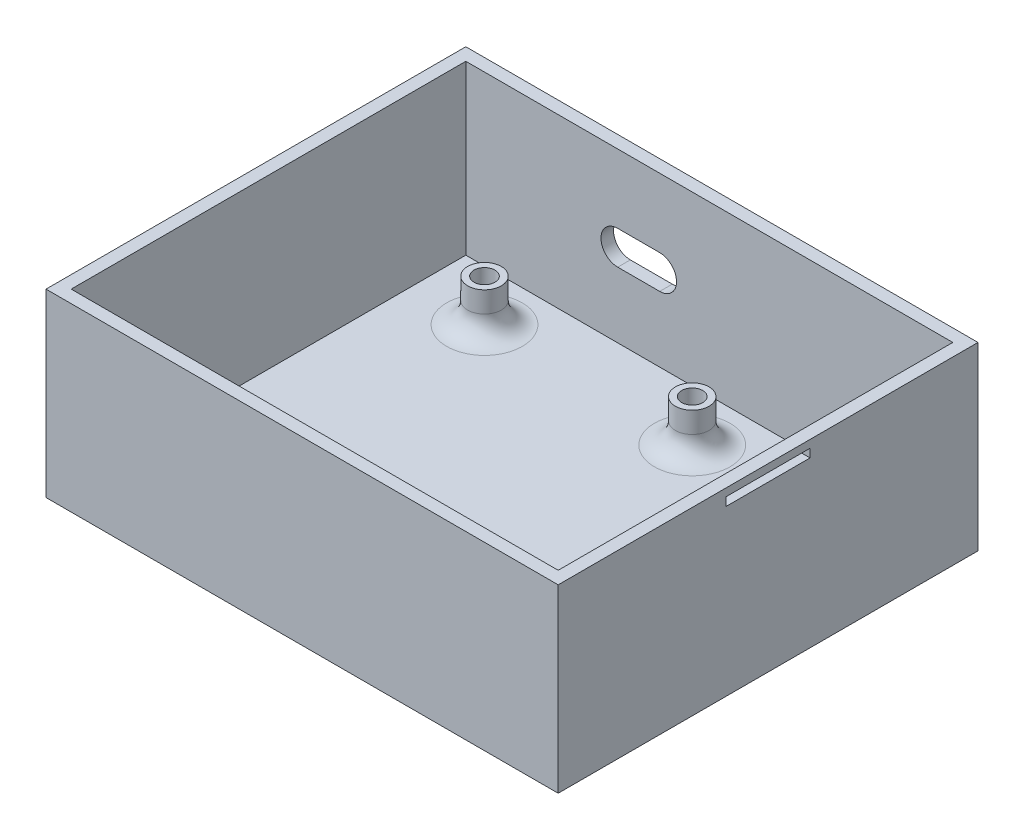
from build123d import *

# Parameters (mm, degrees)
SKETCH1_W           = 122
SKETCH1_H           = 100
BOSS_EXTRUDE1_DEPTH = 3
SKETCH2_W           = 122
SKETCH2_H           = 100
BOSS_EXTRUDE2_DEPTH = 5
SHELL1_T            = -3
SKETCH5_W           = 20
SKETCH5_H           = 2
CUT_EXTRUDE1_DEPTH  = 2.4
SKETCH6_W           = 20
SKETCH6_H           = 2
CUT_EXTRUDE2_DEPTH  = 2.4
SKETCH7_R           = 4
BOSS_EXTRUDE3_DEPTH = 10
SKETCH11_R          = 2.5
CUT_EXTRUDE5_DEPTH  = 7
CUT_EXTRUDE6_DEPTH  = 3
SKETCH13_W          = 18
SKETCH13_H          = 44
BOSS_EXTRUDE5_DEPTH = 3
SKETCH14_W          = 16
SKETCH14_H          = 42
CUT_EXTRUDE7_DEPTH  = 3
FILLET1_R           = 5


with BuildPart() as part:
    # Sketch1 → Boss-Extrude1 (new body)
    with BuildSketch(Plane(origin=(0, 0, 0), x_dir=(1, 0, 0), z_dir=(0, 1, 0))):
        Rectangle(SKETCH1_W, SKETCH1_H)
    extrude(amount=BOSS_EXTRUDE1_DEPTH)



with BuildPart() as body_2:
    # Sketch2 → Boss-Extrude2 (new body)
    with BuildSketch(Plane(origin=(0, 38, 0), x_dir=(1, 0, 0), z_dir=(0, 1, 0))):
        Rectangle(SKETCH2_W, SKETCH2_H)
    extrude(amount=BOSS_EXTRUDE2_DEPTH)


with BuildPart() as part_1:
    add(part.part)

    add(body_2.part)  # loft1 joins it to this body
    # loft from a face of the part (loft1)
    loft([part_1.faces().sort_by_distance((0, 3, 0))[0], part_1.faces().sort_by_distance((0, 38, 0))[0]])

    # Shell1
    shell1_openings = [part_1.faces().sort_by_distance(p)[0] for p in [
        (0, 43, 0),
    ]]
    offset(amount=SHELL1_T, openings=shell1_openings, kind=Kind.INTERSECTION)

    # Sketch5 → Cut-Extrude1 (cut)
    with BuildSketch(Plane.ZY.offset(61)):
        with Locations((0, 40.21846081)):
            Rectangle(SKETCH5_W, SKETCH5_H)
    extrude(amount=-CUT_EXTRUDE1_DEPTH, mode=Mode.SUBTRACT)

    # Sketch6 → Cut-Extrude2 (cut)
    with BuildSketch(Plane(origin=(61, 0, 0), x_dir=(0, 0, -1), z_dir=(1, 0, 0))):
        with Locations((0, 40.177064429)):
            Rectangle(SKETCH6_W, SKETCH6_H)
    extrude(amount=-CUT_EXTRUDE2_DEPTH, mode=Mode.SUBTRACT)

    # Sketch7 → Boss-Extrude3 (add)
    with BuildSketch(Plane(origin=(0, 3, 0), x_dir=(1, 0, 0), z_dir=(0, 1, 0))):
        with Locations(Location((-41.453573848, 34.898312462, 0), (0, 0, 90))):
            Circle(SKETCH7_R)
        with Locations(Location((8.130154931, 34.803413618, 0), (0, 0, 90))):
            Circle(SKETCH7_R)
        with Locations(Location((8.176549105, -31.979822672, 0), (0, 0, 90))):
            Circle(SKETCH7_R)
        with Locations(Location((-41.400089419, -31.94013199, 0), (0, 0, 90))):
            Circle(SKETCH7_R)
    extrude(amount=BOSS_EXTRUDE3_DEPTH)

    # Sketch11 → Cut-Extrude5 (cut)
    with BuildSketch(Plane(origin=(0, 13, 0), x_dir=(1, 0, 0), z_dir=(0, 1, 0))):
        with Locations(Location((-41.400089419, -31.94013199, 0), (0, 0, 270))):
            Circle(SKETCH11_R)
        with Locations(Location((8.176549105, -31.979822672, 0), (0, 0, 270))):
            Circle(SKETCH11_R)
        with Locations(Location((8.130154931, 34.803413618, 0), (0, 0, 270))):
            Circle(SKETCH11_R)
        with Locations(Location((-41.453573848, 34.898312462, 0), (0, 0, 270))):
            Circle(SKETCH11_R)
    extrude(amount=-CUT_EXTRUDE5_DEPTH, mode=Mode.SUBTRACT)

    # Sketch12 → Cut-Extrude6 (cut)
    with BuildSketch(Plane.XY.offset(-47)):
        with BuildLine():
            Line((-21.813500173, 18.623177144), (-11.813500173, 18.623177144))
            ThreePointArc((-11.813500173, 18.623177144), (-7.813500173, 22.623177144), (-11.813500173, 26.623177144))
            Line((-11.813500173, 26.623177144), (-21.813500173, 26.623177144))
            ThreePointArc((-21.813500173, 26.623177144), (-25.813500173, 22.623177144), (-21.813500173, 18.623177144))
        make_face()
    extrude(amount=-CUT_EXTRUDE6_DEPTH, mode=Mode.SUBTRACT)

    # Sketch13 → Boss-Extrude5 (add)
    with BuildSketch(Plane(origin=(0, 3, 0), x_dir=(1, 0, 0), z_dir=(0, 1, 0))):
        with Locations((37.356436199, 16.000571449)):
            Rectangle(SKETCH13_W, SKETCH13_H)
    extrude(amount=BOSS_EXTRUDE5_DEPTH)

    # Sketch14 → Cut-Extrude7 (cut)
    with BuildSketch(Plane(origin=(0, 6, 0), x_dir=(1, 0, 0), z_dir=(0, 1, 0))):
        with Locations((37.356436199, 16.000571449)):
            Rectangle(SKETCH14_W, SKETCH14_H)
    extrude(amount=-CUT_EXTRUDE7_DEPTH, mode=Mode.SUBTRACT)

    # Fillet1
    fillet1_edges = [part_1.edges().sort_by_distance(p)[0] for p in [
        (-41.453573848, 3, -30.898312462),
        (8.130154931, 3, -30.803413618),
        (8.176549105, 3, 35.979822672),
        (-41.400089419, 3, 35.94013199),
    ]]
    fillet(fillet1_edges, radius=FILLET1_R)


solid = part_1.part
